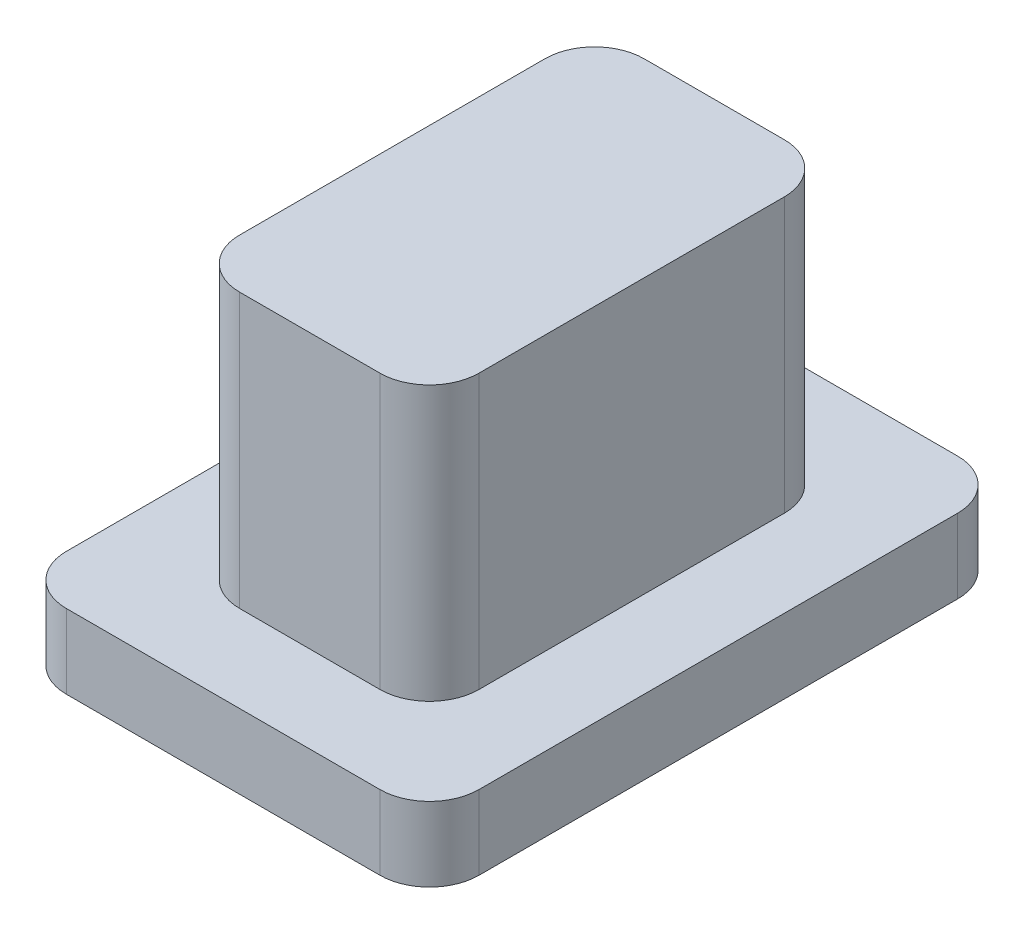
from build123d import *

# Parameters (mm, degrees)
SKETCH_1_W      = 5
SKETCH_1_H      = 7
EXTRUDE_1_DEPTH = 0.9
SKETCH_2_W      = 2.9
SKETCH_2_H      = 4.9
EXTRUDE_2_DEPTH = 3.32
FILLET_1_R      = 0.6


with BuildPart() as part:
    # 草图1 → 凸台-拉伸1 (new body)
    with BuildSketch(Plane(origin=(0, 0, 0), x_dir=(1, 0, 0), z_dir=(0, 1, 0))):
        Rectangle(SKETCH_1_W, SKETCH_1_H)
    extrude(amount=EXTRUDE_1_DEPTH)

    # 草图2 → 凸台-拉伸2 (add)
    with BuildSketch(Plane(origin=(0, 0.9, 0), x_dir=(1, 0, 0), z_dir=(0, 1, 0))):
        Rectangle(SKETCH_2_W, SKETCH_2_H)
    extrude(amount=EXTRUDE_2_DEPTH)

    # 圆角1
    fillet_1_edges = [part.edges().sort_by_distance(p)[0] for p in [
        (1.45, 2.56, 2.45),
        (1.45, 2.56, -2.45),
        (-1.45, 2.56, -2.45),
        (-1.45, 2.56, 2.45),
        (2.5, 0.45, 3.5),
        (-2.5, 0.45, 3.5),
        (-2.5, 0.45, -3.5),
        (2.5, 0.45, -3.5),
    ]]
    fillet(fillet_1_edges, radius=FILLET_1_R)


solid = part.part
